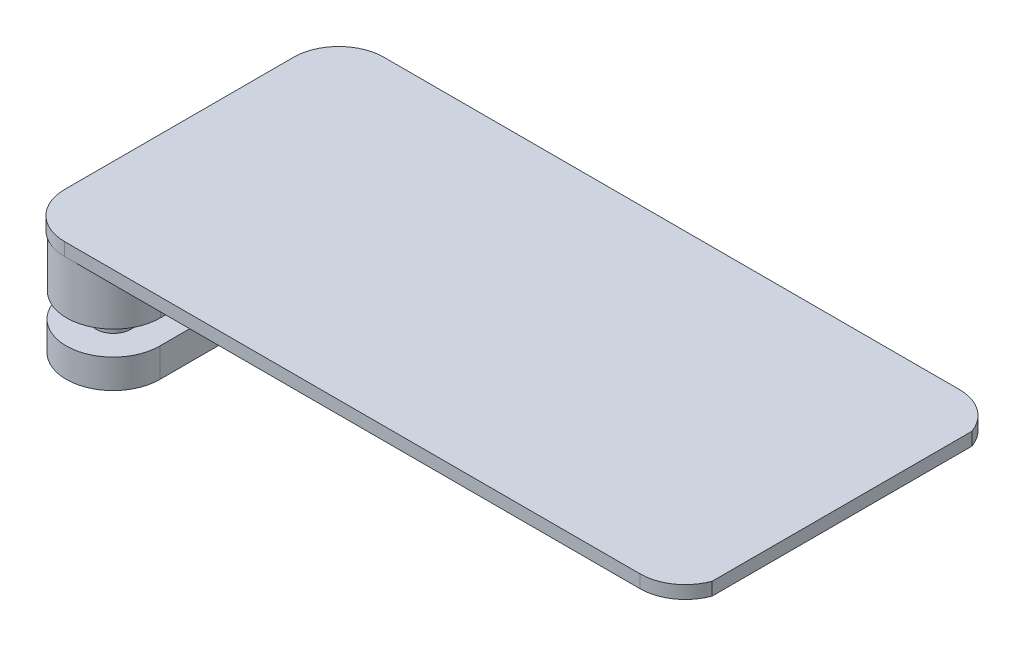
from build123d import *

# Parameters (mm, degrees)
BOSS_EXTRUDE1_DEPTH = 4.5
BOSS_EXTRUDE2_DEPTH = 3.8
BOSS_EXTRUDE3_DEPTH = 8.1
SKETCH5_W           = 103.25
SKETCH5_H           = 49.520314098
BOSS_EXTRUDE4_DEPTH = 2
FILLET1_R           = 7
SKETCH6_W           = 74.836382047
SKETCH6_H           = 26.769621583
CUT_EXTRUDE1_DEPTH  = 0.42


with BuildPart() as part:
    # Sketch1 → Boss-Extrude1 (new body)
    with BuildSketch(Plane(origin=(0, 0, 0), x_dir=(1, 0, 0), z_dir=(0, 1, 0))):
        with BuildLine():
            Line((7.25, 0), (7.25, -35))
            ThreePointArc((7.25, -35), (0, -42.25), (-7.25, -35))
            Line((-7.25, -35), (-7.25, 0))
            ThreePointArc((-7.25, 0), (0, 7.25), (7.25, 0))
        make_face()
    extrude(amount=BOSS_EXTRUDE1_DEPTH)

    # Sketch3 → Boss-Extrude2 (add)
    with BuildSketch(Plane(origin=(0, 4.5, 0), x_dir=(1, 0, 0), z_dir=(0, 1, 0))):
        with BuildLine():
            Line((-2.622571491, -0.457666807), (-2.622571491, -35.011296081))
            ThreePointArc((-2.622571491, -35.011296081), (0.070610389, -37.704477961), (2.763792269, -35.011296081))
            Line((2.763792269, -35.011296081), (2.763792269, -0.457666807))
            ThreePointArc((2.763792269, -0.457666807), (0.070610389, 2.718626164), (-2.622571491, -0.457666807))
        make_face()
    extrude(amount=BOSS_EXTRUDE2_DEPTH)

    # Sketch4 → Boss-Extrude3 (add)
    with BuildSketch(Plane(origin=(0, 8.3, 0), x_dir=(1, 0, 0), z_dir=(0, 1, 0))):
        with BuildLine():
            Line((7.25308141, 0.014627933), (7.323691799, -34.996668148))
            ThreePointArc((7.323691799, -34.996668148), (0.085238322, -42.264377491), (-7.182471021, -35.025924014))
            Line((-7.182471021, -35.025924014), (-7.25308141, -0.014627933))
            ThreePointArc((-7.25308141, -0.014627933), (-0.014627933, 7.25308141), (7.25308141, 0.014627933))
        make_face()
    extrude(amount=BOSS_EXTRUDE3_DEPTH)

    # Sketch5 → Boss-Extrude4 (add)
    with BuildSketch(Plane(origin=(0, 16.4, 0), x_dir=(1, 0, 0), z_dir=(0, 1, 0))):
        with Locations((44.371903839, -17.507075639)):
            Rectangle(SKETCH5_W, SKETCH5_H)
    extrude(amount=BOSS_EXTRUDE4_DEPTH)

    # Fillet1
    fillet1_edges = [part.edges().sort_by_distance(p)[0] for p in [
        (95.996903839, 17.4, 42.267232688),
        (95.996903839, 17.4, -7.25308141),
        (-7.253096161, 17.4, -7.25308141),
        (-7.253096161, 17.4, 42.267232688),
    ]]
    fillet(fillet1_edges, radius=FILLET1_R)

    # Sketch6 → Cut-Extrude1 (cut)
    with BuildSketch(Plane(origin=(95.996903839, 0, 0), x_dir=(0, 0, -1), z_dir=(1, 0, 0))):
        with Locations((-22.928368507, 17.221399119)):
            Rectangle(SKETCH6_W, SKETCH6_H)
    extrude(amount=-CUT_EXTRUDE1_DEPTH, mode=Mode.SUBTRACT)


solid = part.part
